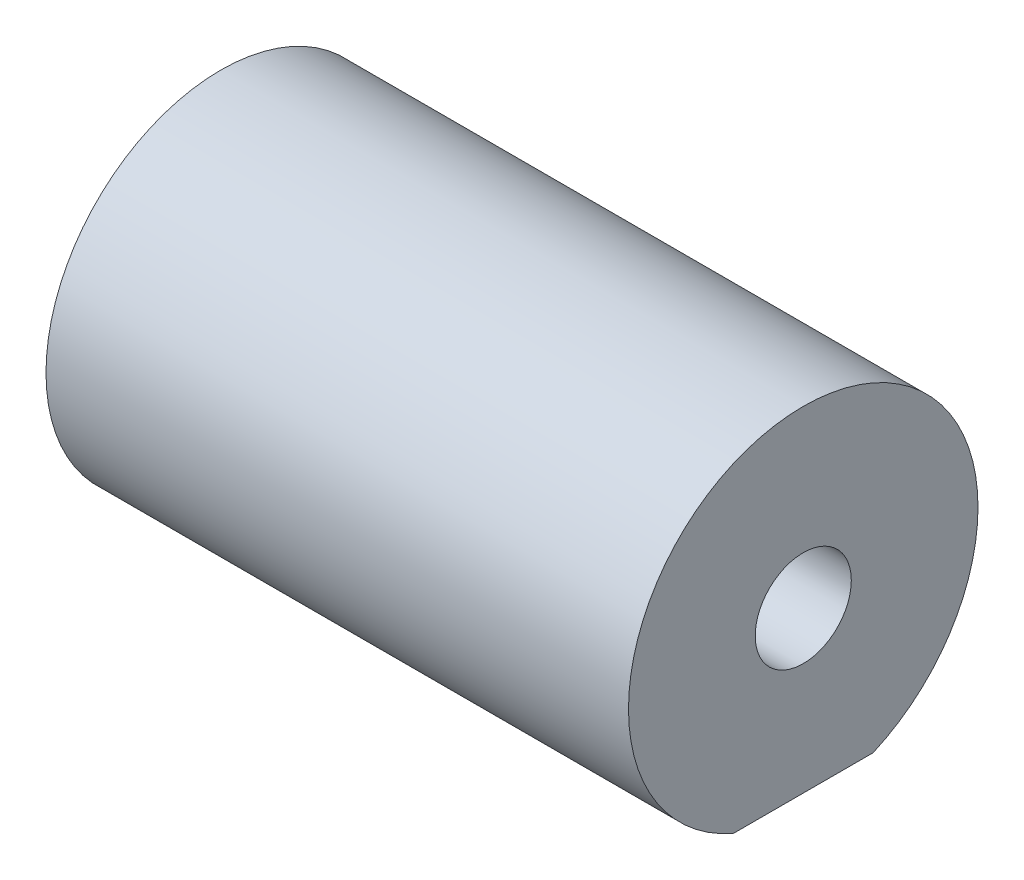
from build123d import *

# Parameters (mm, degrees)
SKETCH_1_R          = 6
EXTRUDE_1_DEPTH     = 20
SKETCH_3_R          = 1.65
CUT_EXTRUDE_2_DEPTH = 22.725560982
CUT_EXTRUDE_1_DEPTH = 22.725560982


with BuildPart() as part:
    # ｽｹｯﾁ1 → ﾎﾞｽ - 押し出し1 (new body)
    with BuildSketch(Plane(origin=(0, 0, 0), x_dir=(0, 0, -1), z_dir=(1, 0, 0))):
        Circle(SKETCH_1_R)
    extrude(amount=EXTRUDE_1_DEPTH)

    # ｽｹｯﾁ3 → ｶｯﾄ - 押し出し2 (cut, through all)
    with BuildSketch(Plane(origin=(20, 0, 0), x_dir=(0, 0, -1), z_dir=(1, 0, 0))):
        Circle(SKETCH_3_R)
    extrude(amount=-CUT_EXTRUDE_2_DEPTH, mode=Mode.SUBTRACT)

    # ｽｹｯﾁ2 → ｶｯﾄ - 押し出し1 (cut, through all)
    with BuildSketch(Plane(origin=(20, 0, 0), x_dir=(0, 0, -1), z_dir=(1, 0, 0))):
        with BuildLine():
            Line((2.397915762, -5.5), (-2.397915762, -5.5))
            ThreePointArc((-2.397915762, -5.5), (0, -6), (2.397915762, -5.5))
        make_face()
    extrude(amount=-CUT_EXTRUDE_1_DEPTH, mode=Mode.SUBTRACT)


solid = part.part
